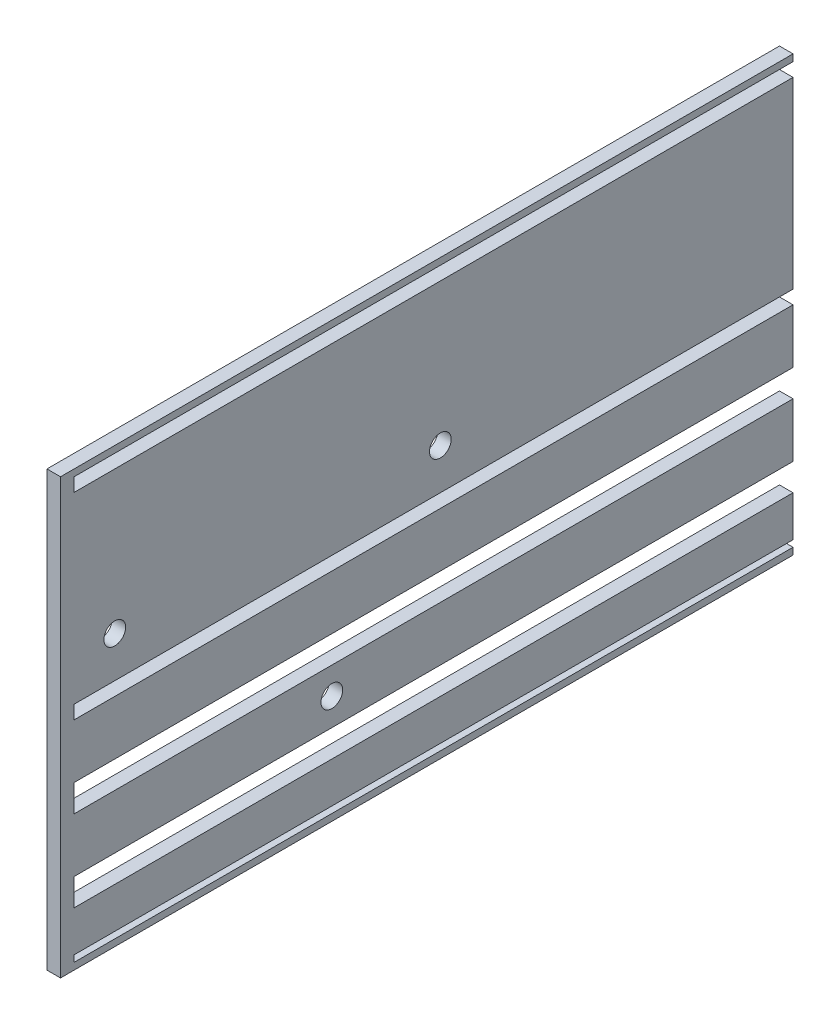
from build123d import *

# Parameters (mm, degrees)
SKETCH1_R           = 2.54
BOSS_EXTRUDE1_DEPTH = 3.175


with BuildPart() as part:
    # Sketch1 → Boss-Extrude1 (new body)
    with BuildSketch(Plane(origin=(0, 0, 0), x_dir=(0, 0, -1), z_dir=(1, 0, 0))):
        Polygon((53.108364313, 44.988743573), (-118.341635687, 44.988743573), (-118.341635687, -56.611256427), (53.108364313, -56.611256427), (53.108364313, -55.023756427), (-115.166635687, -55.023756427), (-115.166635687, -53.504836427), (53.108364313, -53.504836427), (53.108364313, -50.261256427), (53.108364313, -43.979836427), (-115.166635687, -43.979836427), (-115.166635687, -37.629836427), (53.108364313, -37.629836427), (53.108364313, -24.929836427), (-115.166635687, -24.929836427), (-115.166635687, -18.579836427), (53.108364313, -18.579836427), (53.108364313, -5.879836427), (-115.166635687, -5.879836427), (-115.166635687, -2.704836427), (53.108364313, -2.704836427), (53.108364313, 25.938743573), (53.108364313, 40.226243573), (-115.166635687, 40.226243573), (-115.166635687, 43.401243573), (53.108364313, 43.401243573), align=None)
        with Locations((-54.841635687, -31.211256427)):
            Circle(SKETCH1_R, mode=Mode.SUBTRACT)
        with Locations((-105.641635687, 6.888743573)):
            Circle(SKETCH1_R, mode=Mode.SUBTRACT)
        with Locations((-29.441635687, 6.888743573)):
            Circle(SKETCH1_R, mode=Mode.SUBTRACT)
    extrude(amount=BOSS_EXTRUDE1_DEPTH)


solid = part.part
